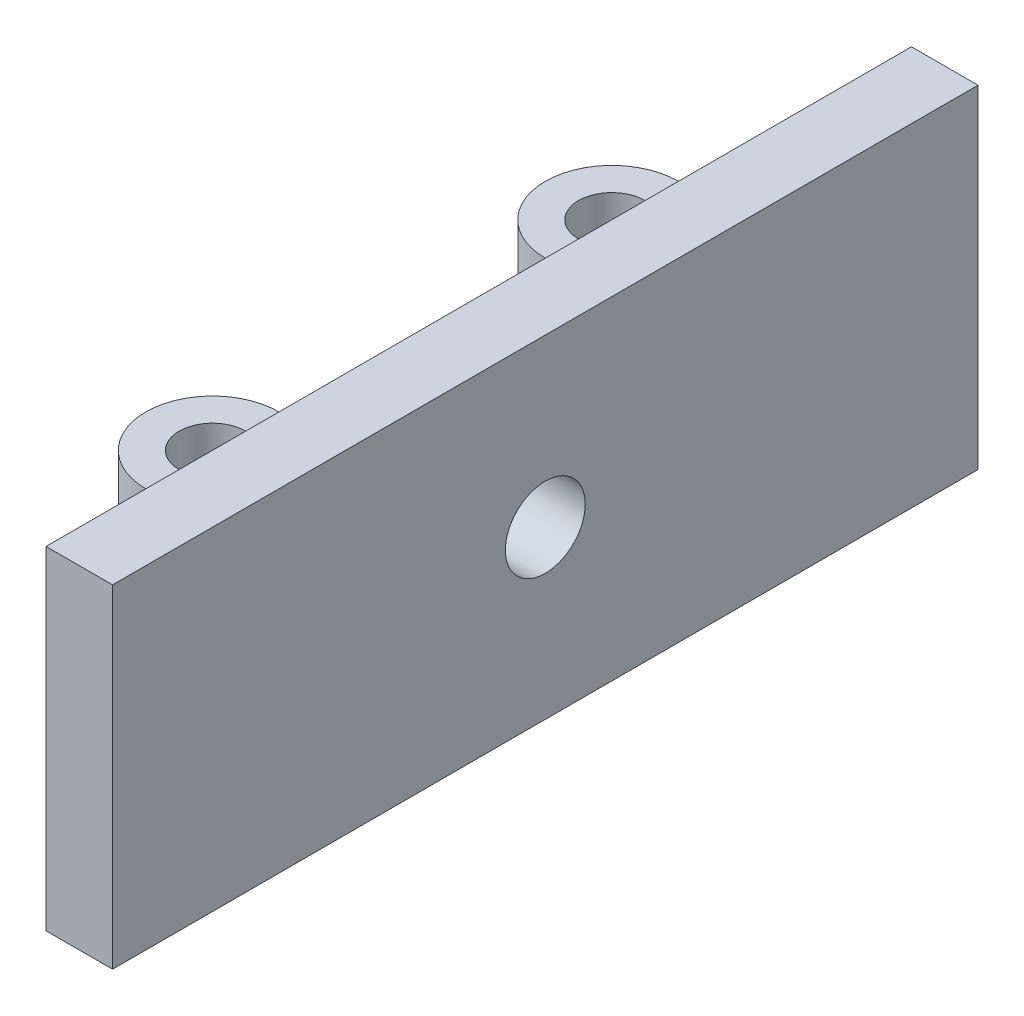
from build123d import *

# Parameters (mm, degrees)
SKETCH1_R               = 2.5
BOSS_EXTRUDE1_DEPTH     = 12.5
CUT_EXTRUDE1_DEPTH      = 38.91437722
CUT_EXTRUDE1_DEPTH_BACK = 38.91437722
SKETCH2_W               = 10
SKETCH2_H               = 5
F_6_0MM_DOWEL_HOLE1_D   = 6


with BuildPart() as part:
    # Sketch1 → Boss-Extrude1 (new, symmetric)
    with BuildSketch(Plane(origin=(0, 0, 0), x_dir=(1, 0, 0), z_dir=(0, 1, 0))):
        with BuildLine():
            Line((-10, 10), (-5, 10))
            Line((-5, 10), (-5, -10))
            Line((-5, -10), (-10, -10))
            ThreePointArc((-10, -10), (-15, -15), (-10, -20))
            Line((-10, -20), (-5, -20))
            Line((-5, -20), (-5, -32.5))
            Line((-5, -32.5), (0, -32.5))
            Line((0, -32.5), (0, 32.5))
            Line((0, 32.5), (-5, 32.5))
            Line((-5, 32.5), (-5, 20))
            Line((-5, 20), (-10, 20))
            ThreePointArc((-10, 20), (-15, 15), (-10, 10))
        make_face()
        with Locations(Location((-10, 15, 0), (0, 0, 270))):
            Circle(SKETCH1_R, mode=Mode.SUBTRACT)
        with Locations(Location((-10, -15, 0), (0, 0, 270))):
            Circle(SKETCH1_R, mode=Mode.SUBTRACT)
    extrude(amount=BOSS_EXTRUDE1_DEPTH, both=True)

    # Sketch2 → Cut-Extrude1 (cut, two sides: drawn at the far end of the back side and taken through both)
    with BuildSketch(Plane.XY.offset(-CUT_EXTRUDE1_DEPTH_BACK)):
        with Locations((-10, 10)):
            Rectangle(SKETCH2_W, SKETCH2_H)
        with Locations((-10, -10)):
            Rectangle(SKETCH2_W, SKETCH2_H)
    extrude(amount=CUT_EXTRUDE1_DEPTH + CUT_EXTRUDE1_DEPTH_BACK, mode=Mode.SUBTRACT)

    # Ø6.0mm Dowel Hole1 (through all)
    with Locations(Plane(origin=(0, 0, 0), x_dir=(0, 0, -1), z_dir=(1, 0, 0))):
        with Locations((0, 0)):
            Hole(F_6_0MM_DOWEL_HOLE1_D / 2)


solid = part.part
